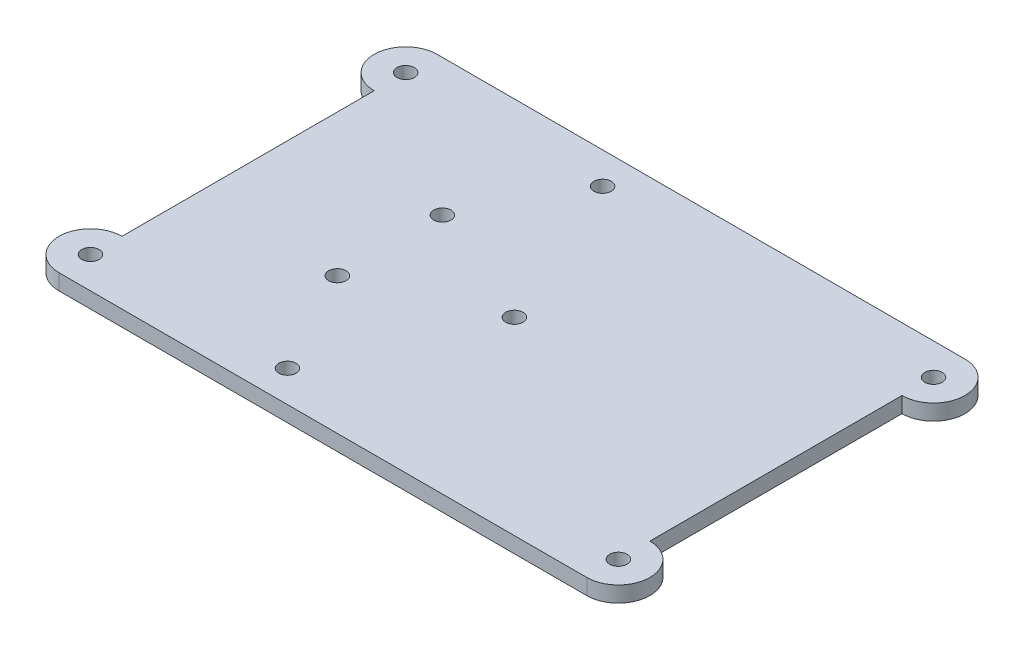
from build123d import *

# Parameters (mm, degrees)
SKETCH_1_R      = 1.65
EXTRUDE_1_DEPTH = 3


with BuildPart() as part:
    # 草图1 → 凸台-拉伸1 (new body)
    with BuildSketch(Plane(origin=(0, 0, 0), x_dir=(1, 0, 0), z_dir=(0, 1, 0))):
        with BuildLine():
            Line((71.874301032, 41.927422609), (71.874301032, -6.072577391))
            ThreePointArc((71.874301032, -6.072577391), (77.874301032, -12.072577391), (71.874301032, -18.072577391))
            Line((71.874301032, -18.072577391), (-28.625698968, -18.072577391))
            ThreePointArc((-28.625698968, -18.072577391), (-34.625698968, -12.072577391), (-28.625698968, -6.072577391))
            Line((-28.625698968, -6.072577391), (-28.625698968, 41.927422609))
            ThreePointArc((-28.625698968, 41.927422609), (-34.625698968, 47.927422609), (-28.625698968, 53.927422609))
            Line((-28.625698968, 53.927422609), (71.874301032, 53.927422609))
            ThreePointArc((71.874301032, 53.927422609), (77.874301032, 47.927422609), (71.874301032, 41.927422609))
        make_face()
        with Locations(Location((-28.625698968, 47.927422609, 0), (0, 0, 270))):
            Circle(SKETCH_1_R, mode=Mode.SUBTRACT)
        with Locations(Location((8.874301032, 47.927422609, 0), (0, 0, 270))):
            Circle(SKETCH_1_R, mode=Mode.SUBTRACT)
        with Locations(Location((71.874301032, 47.927422609, 0), (0, 0, 270))):
            Circle(SKETCH_1_R, mode=Mode.SUBTRACT)
        with Locations(Location((-28.625698968, -12.072577391, 0), (0, 0, 270))):
            Circle(SKETCH_1_R, mode=Mode.SUBTRACT)
        with Locations(Location((8.874301032, -12.072577391, 0), (0, 0, 270))):
            Circle(SKETCH_1_R, mode=Mode.SUBTRACT)
        with Locations(Location((71.874301032, -12.072577391, 0), (0, 0, 270))):
            Circle(SKETCH_1_R, mode=Mode.SUBTRACT)
        with Locations(Location((-1.625698968, 27.927422609, 0), (0, 0, 270))):
            Circle(SKETCH_1_R, mode=Mode.SUBTRACT)
        with Locations(Location((-1.625698968, 7.927422609, 0), (0, 0, 270))):
            Circle(SKETCH_1_R, mode=Mode.SUBTRACT)
        with Locations(Location((22.074301032, 17.927422609, 0), (0, 0, 270))):
            Circle(SKETCH_1_R, mode=Mode.SUBTRACT)
    extrude(amount=EXTRUDE_1_DEPTH)


solid = part.part
